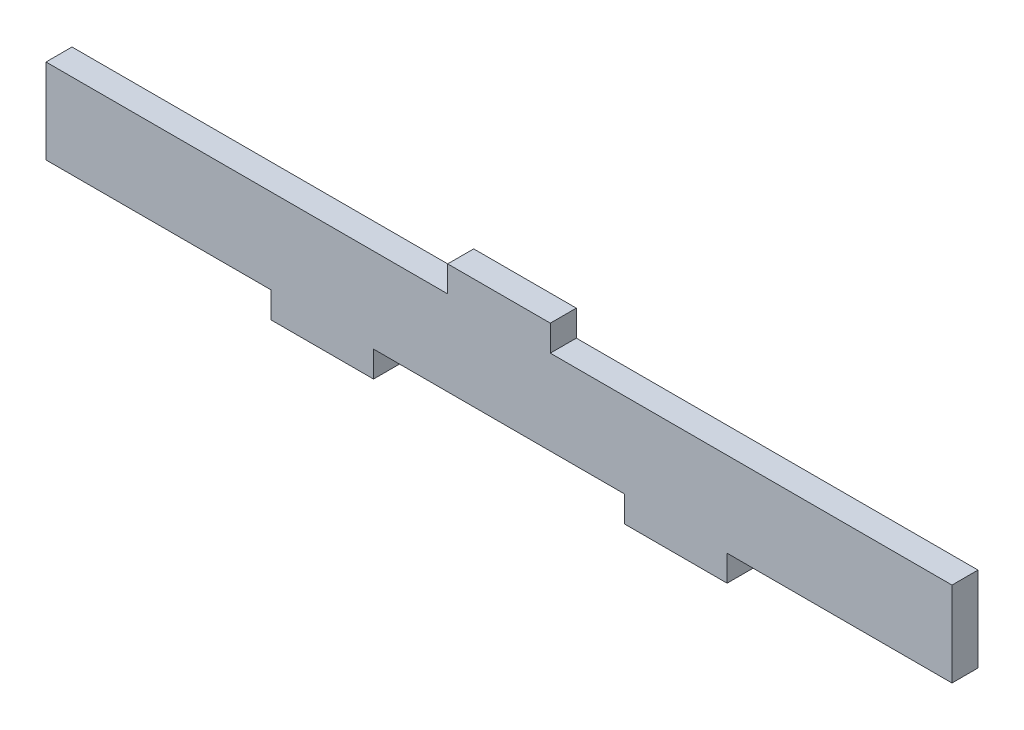
from build123d import *

# Parameters (mm, degrees)
SKETCH1_W               = 177.8
SKETCH1_H               = 25.4
BOSS_EXTRUDE1_DEPTH     = 4.826
SKETCH2_W               = 46.566666667
SKETCH2_H               = 4.826
SKETCH2_W_2             = 46.566666666
BOTTOM_EDGE_SLOTS_DEPTH = 180.669948172
SKETCH3_W               = 79.375
SKETCH3_H               = 4.826
TOP_EDGE_SLOTS_DEPTH    = 180.669948172
SKETCH4_W               = 4.826
SKETCH4_H               = 15.748
EDGE_CUTS_DEPTH         = 180.669948172


with BuildPart() as part:
    # Sketch1 → Boss-Extrude1 (new body)
    with BuildSketch(Plane.XY):
        with Locations((88.9, 12.7)):
            Rectangle(SKETCH1_W, SKETCH1_H)
    extrude(amount=BOSS_EXTRUDE1_DEPTH)

    # Sketch2 → Bottom Edge Slots (cut, through all)
    with BuildSketch(Plane.XY.offset(4.826)):
        with Locations((23.283333333, 2.413)):
            Rectangle(SKETCH2_W, SKETCH2_H)
        with Locations((88.9, 2.413)):
            Rectangle(SKETCH2_W_2, SKETCH2_H)
        with Locations((154.516666667, 2.413)):
            Rectangle(SKETCH2_W, SKETCH2_H)
    extrude(amount=-BOTTOM_EDGE_SLOTS_DEPTH, mode=Mode.SUBTRACT)

    # Sketch3 → Top Edge Slots (cut, through all)
    with BuildSketch(Plane.XY.offset(4.826)):
        with Locations((39.6875, 22.987)):
            Rectangle(SKETCH3_W, SKETCH3_H)
        with Locations((138.1125, 22.987)):
            Rectangle(SKETCH3_W, SKETCH3_H)
    extrude(amount=-TOP_EDGE_SLOTS_DEPTH, mode=Mode.SUBTRACT)

    # Sketch4 → Edge Cuts (cut, through all)
    with BuildSketch(Plane.XY.offset(4.826)):
        with Locations((2.413, 12.7)):
            Rectangle(SKETCH4_W, SKETCH4_H)
        with Locations((175.387, 12.7)):
            Rectangle(SKETCH4_W, SKETCH4_H)
    extrude(amount=-EDGE_CUTS_DEPTH, mode=Mode.SUBTRACT)


solid = part.part
